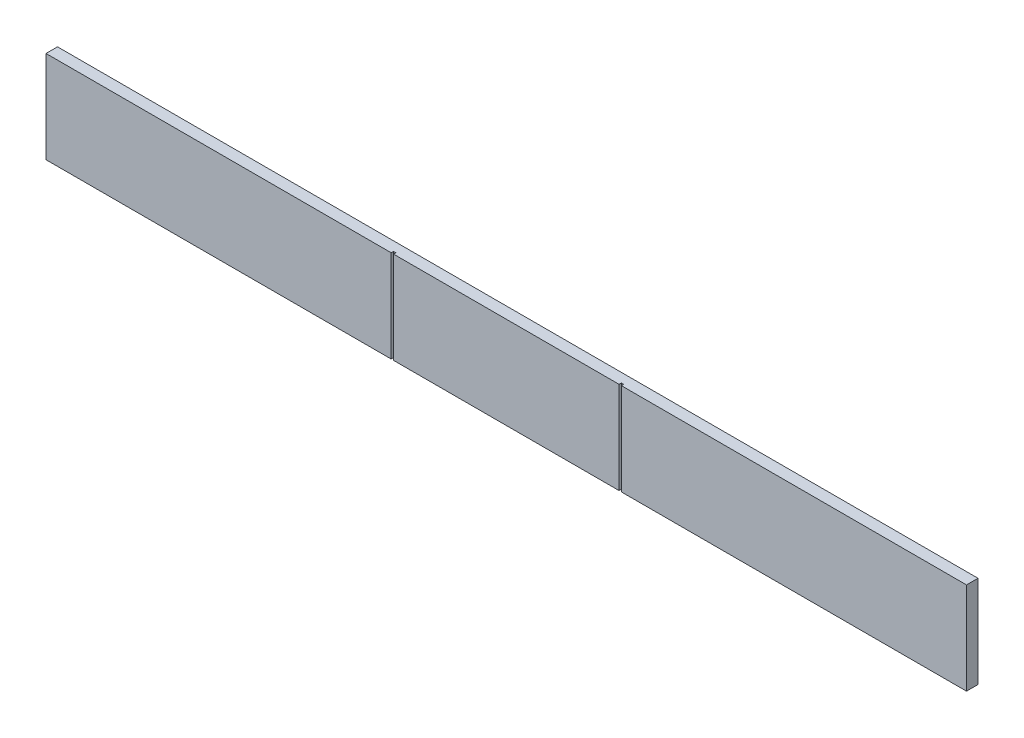
from build123d import *

# Parameters (mm, degrees)
SKETCH1_W           = 508
SKETCH1_H           = 50.8
BOSS_EXTRUDE1_DEPTH = 6.35
SKETCH2_W           = 1.27
SKETCH2_H           = 50.8
CUT_EXTRUDE1_DEPTH  = 1.27


with BuildPart() as part:
    # Sketch1 → Boss-Extrude1 (new body)
    with BuildSketch(Plane.XY):
        Rectangle(SKETCH1_W, SKETCH1_H)
    extrude(amount=BOSS_EXTRUDE1_DEPTH)

    # Sketch2 → Cut-Extrude1 (cut)
    with BuildSketch(Plane.XY.offset(6.35)):
        with Locations((-62.865, 0)):
            Rectangle(SKETCH2_W, SKETCH2_H)
        with Locations((62.865, 0)):
            Rectangle(SKETCH2_W, SKETCH2_H)
    extrude(amount=-CUT_EXTRUDE1_DEPTH, mode=Mode.SUBTRACT)


solid = part.part
